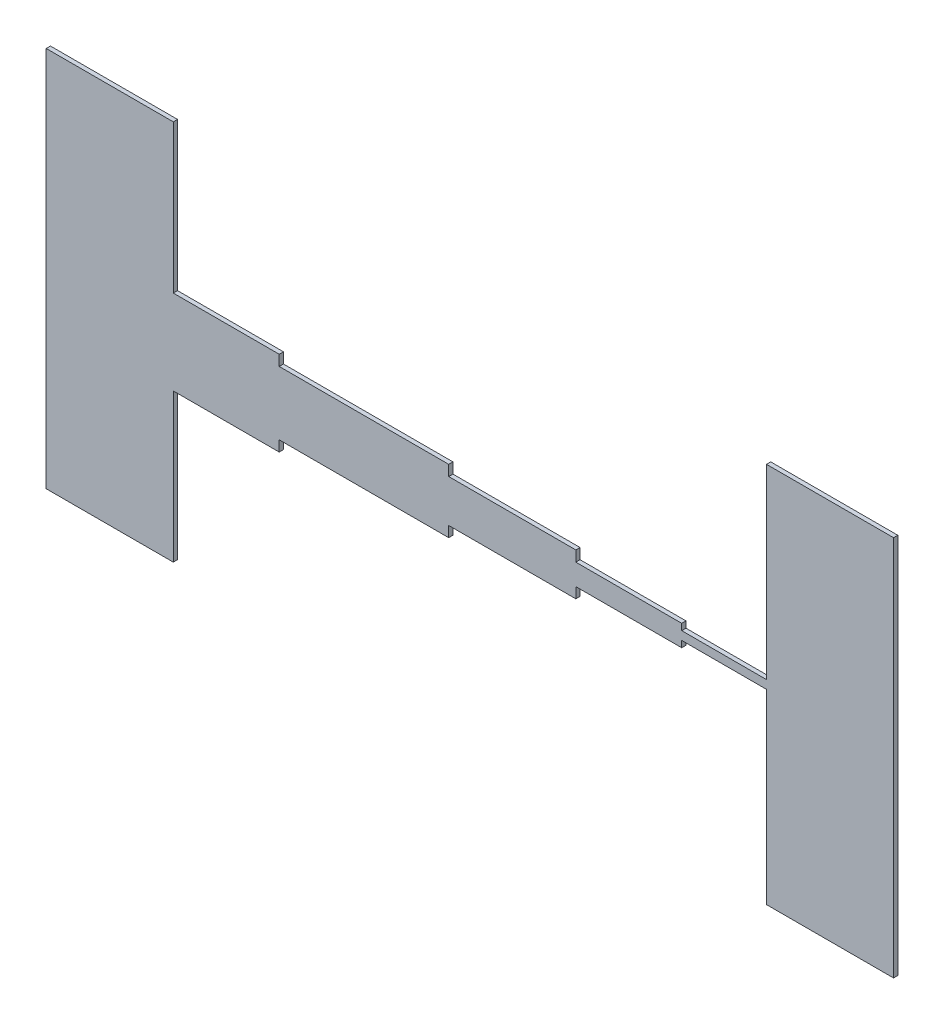
from build123d import *

# Parameters (mm, degrees)
BOSS_EXTRUDE1_DEPTH = 0.1
SCALE1_SCALE        = 1000


with BuildPart() as part:
    # Sketch2 → Boss-Extrude1 (new body)
    with BuildSketch(Plane.XY):
        Polygon((0, 0), (3, 0), (3, 3.5), (5.5, 3.5), (5.5, 3.75), (9.5, 3.75), (9.5, 4), (12.5, 4), (12.5, 4.25), (15, 4.25), (15, 4.4), (17, 4.4), (17, 0), (20, 0), (20, 9), (17, 9), (17, 4.6), (15, 4.6), (15, 4.75), (12.5, 4.75), (12.5, 5), (9.5, 5), (9.5, 5.25), (5.5, 5.25), (5.5, 5.5), (3, 5.5), (3, 9), (0, 9), align=None)
    extrude(amount=-BOSS_EXTRUDE1_DEPTH)


with BuildPart() as part_1:
    # Scale1: scaled about (9.516690596, 4.5, -0.05)
    add(part.part.scale(SCALE1_SCALE).moved(Location((-9507.173905404, -4495.5, 49.95))))


solid = part_1.part
